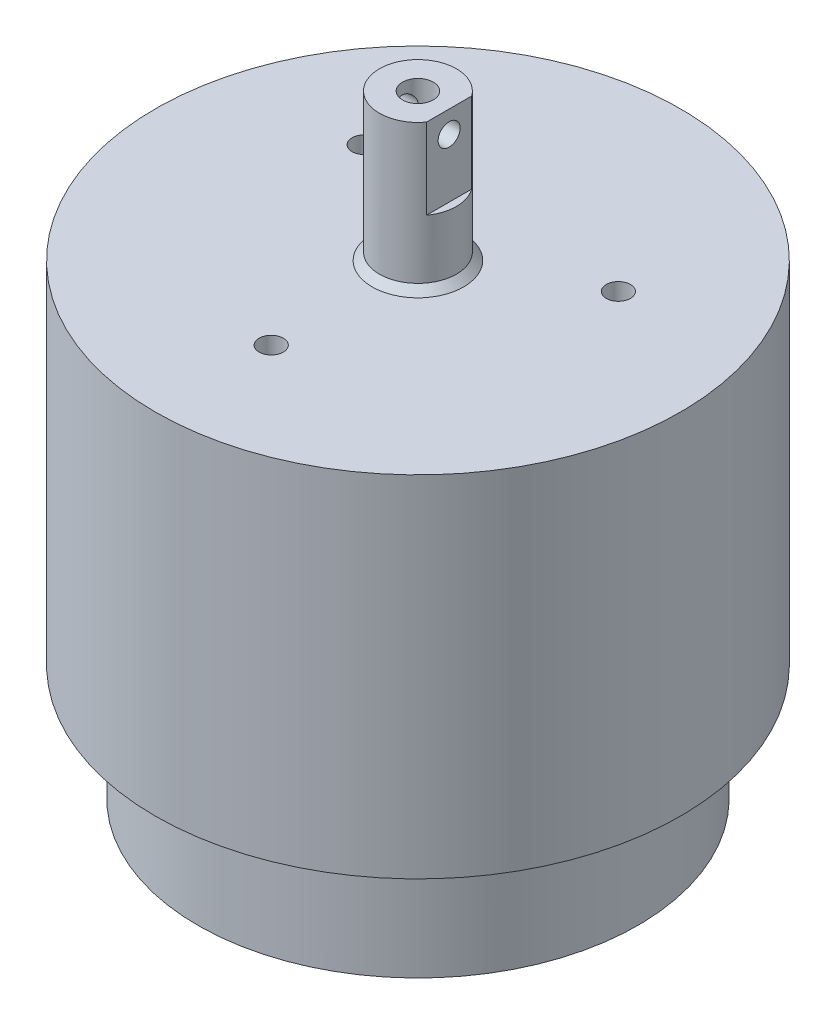
from build123d import *

# Parameters (mm, degrees)
SKETCH_1_R          = 35.8
EXTRUDE_1_DEPTH     = 47.7
SKETCH_2_R          = 5.25
EXTRUDE_2_DEPTH     = 20
SKETCH_3_W          = 7.138794325
SKETCH_3_H          = 6.164414002
CUT_EXTRUDE_1_DEPTH = 11
SKETCH_4_R          = 1.5
CUT_EXTRUDE_2_DEPTH = 87.422985947
CHAMFER_1_SIZE      = 1
SKETCH_5_R          = 1.65
CUT_EXTRUDE_3_DEPTH = 6
SKETCH_6_R          = 2.1
CUT_EXTRUDE_4_DEPTH = 24
SKETCH_7_R          = 30
EXTRUDE_3_DEPTH     = 15.8
SKETCH_8_W          = 3.2
SKETCH_8_H          = 12
CUT_EXTRUDE_5_DEPTH = 68.4


with BuildPart() as part:
    # 草图1 → 凸台-拉伸1 (new body)
    with BuildSketch(Plane(origin=(0, 0, 0), x_dir=(1, 0, 0), z_dir=(0, 1, 0))):
        with Locations(Location((0, 0, 0), (0, 0, 270))):
            Circle(SKETCH_1_R)
    extrude(amount=EXTRUDE_1_DEPTH)

    # 草图2 → 凸台-拉伸2 (add)
    with BuildSketch(Plane(origin=(0, 47.7, 0), x_dir=(1, 0, 0), z_dir=(0, 1, 0))):
        with Locations(Location((0, 0, 0), (0, 0, 270))):
            Circle(SKETCH_2_R)
    extrude(amount=EXTRUDE_2_DEPTH)

    # 草图3 → 切除-拉伸1 (cut)
    with BuildSketch(Plane(origin=(0, 67.7, 0), x_dir=(1, 0, 0), z_dir=(0, 1, 0))):
        with Locations((7.819397163, 0)):
            Rectangle(SKETCH_3_W, SKETCH_3_H)
    extrude(amount=-CUT_EXTRUDE_1_DEPTH, mode=Mode.SUBTRACT)

    # 草图4 → 切除-拉伸2 (cut, through all)
    with BuildSketch(Plane(origin=(4.25, 0, 0), x_dir=(0, 0, -1), z_dir=(1, 0, 0))):
        with Locations((0, 64.7)):
            Circle(SKETCH_4_R)
    extrude(amount=-CUT_EXTRUDE_2_DEPTH, mode=Mode.SUBTRACT)

    # 倒角1
    chamfer_1_edges = [part.edges().sort_by_distance(p)[0] for p in [
        (0, 47.7, -5.25),
    ]]
    chamfer(chamfer_1_edges, length=CHAMFER_1_SIZE)

    # 草图5 → 切除-拉伸3 (cut)
    with BuildSketch(Plane(origin=(0, 47.7, 0), x_dir=(1, 0, 0), z_dir=(0, 1, 0))):
        with Locations(Location((0, -20, 0), (0, 0, 270))):
            Circle(SKETCH_5_R)
        with Locations(Location((-17.320508076, 10, 0), (0, 0, 270))):
            Circle(SKETCH_5_R)
        with Locations(Location((17.320508076, 10, 0), (0, 0, 270))):
            Circle(SKETCH_5_R)
    extrude(amount=-CUT_EXTRUDE_3_DEPTH, mode=Mode.SUBTRACT)

    # 草图6 → 切除-拉伸4 (cut)
    with BuildSketch(Plane(origin=(0, 67.7, 0), x_dir=(1, 0, 0), z_dir=(0, 1, 0))):
        with Locations(Location((0, 0, 0), (0, 0, 270))):
            Circle(SKETCH_6_R)
    extrude(amount=-CUT_EXTRUDE_4_DEPTH, mode=Mode.SUBTRACT)

    # 草图7 → 凸台-拉伸3 (add)
    with BuildSketch(Plane.XZ):
        with Locations(Location((0, 0, 0), (0, 0, 90))):
            Circle(SKETCH_7_R)
    extrude(amount=EXTRUDE_3_DEPTH)

    # 草图8 → 切除-拉伸5 (cut, symmetric)
    with BuildSketch(Plane(origin=(0, 0, 0), x_dir=(0, 0, -1), z_dir=(1, 0, 0))):
        with Locations((28.4, -6)):
            Rectangle(SKETCH_8_W, SKETCH_8_H)
    extrude(amount=CUT_EXTRUDE_5_DEPTH, both=True, mode=Mode.SUBTRACT)


solid = part.part
